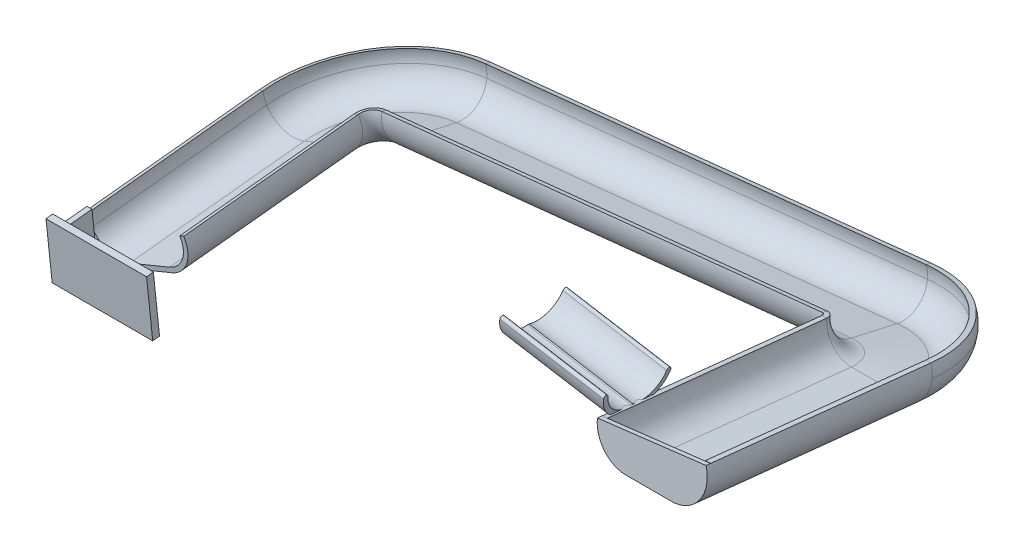
from build123d import *

# Parameters (mm, degrees)
SKETCH_2_W      = 0.546487167
SKETCH_2_H      = 4.918384508
EXTRUDE_1_DEPTH = 3.6
EXTRUDE_2_DEPTH = 11
EXTRUDE_START   = 0.5
EXTRUDE_4_DEPTH = 0.5
EXTRUDE_5_DEPTH = 11.5


with BuildPart() as part:
    # 扫描1: sweep along a curve in space
    with BuildLine() as sweep_1_path:
        Line((60, 6.926609333, 5.902285627), (60, 9.459381174, 30))
        ThreePointArc((54.097714373, 5.685898899, 0), (58.275153099, 6.306254116, 1.724846901), (60, 6.926609333, 5.902285627))
        Line((5.902285627, 0.620355217, 0), (54.097714373, 5.685898899, 0))
        ThreePointArc((0, -0.620355217, 5.902285627), (1.724846901, 0, 1.724846901), (5.902285627, 0.620355217, 0))
        Line((0, -0.620355217, 5.902285627), (0, -2.627605882, 25))
    # 草图1 → 扫描1 (sweep)
    with BuildSketch(Plane(origin=(60, 9.459381174, 30), x_dir=(1, 0, 0), z_dir=(0, 0.10452846326765572, 0.9945218953682732))):
        with BuildLine():
            Line((-6, 3.25), (-5.5, 3.25))
            ThreePointArc((-5.5, 3.25), (-4.621320344, 1.128679656), (-2.5, 0.25))
            Line((-2.5, 0.25), (2.5, 0.25))
            ThreePointArc((2.5, 0.25), (4.621320344, 1.128679656), (5.5, 3.25))
            ThreePointArc((5.5, 3.25), (5.42374237, 3.922109036), (5.198846296, 4.56004911))
            Line((5.198846296, 4.56004911), (5.745577195, 4.56004911))
            ThreePointArc((5.745577195, 4.56004911), (5.935805596, 3.917262998), (6, 3.25))
            ThreePointArc((6, 3.25), (4.974873734, 0.775126266), (2.5, -0.25))
            Line((2.5, -0.25), (-2.5, -0.25))
            ThreePointArc((-2.5, -0.25), (-4.974873734, 0.775126266), (-6, 3.25))
        make_face()
    sweep(path=sweep_1_path.line)

    # 草图2 → 凸台-拉伸1 (add)
    with BuildSketch(Plane(origin=(0, -2.627605882, 25), x_dir=(1, 0, 0), z_dir=(0, -0.1045284632676537, 0.9945218953682733))):
        with Locations((-6.423000936, 0.189458264)):
            Rectangle(SKETCH_2_W, SKETCH_2_H)
    extrude(amount=EXTRUDE_1_DEPTH)

    # 草图3 → 凸台-拉伸2 (add)
    with BuildSketch(Plane.ZY.offset(6.696244519)):
        Polygon((28.343027017, -5.261208499), (29.016349178, 1.145023935), (29.760098321, 1.06685275), (29.08677616, -5.339379684), align=None)
    extrude(amount=-EXTRUDE_2_DEPTH)

    # 草图5 → 凸台-拉伸4 (add)
    with BuildSketch(Plane(origin=(0, 3.222030449, 30.655571978), x_dir=(1, 0, 0), z_dir=(0, 0.10452846326765573, 0.9945218953682732)).offset(EXTRUDE_START)):
        with BuildLine():
            Line((65.745577195, 10.831756906), (54, 9.521707796))
            ThreePointArc((54, 9.521707796), (55.025126266, 7.046834062), (57.5, 6.021707796))
            Line((57.5, 6.021707796), (62.5, 6.021707796))
            ThreePointArc((62.5, 6.021707796), (64.974873734, 7.046834062), (66, 9.521707796))
            ThreePointArc((66, 9.521707796), (65.935805596, 10.188970794), (65.745577195, 10.831756906))
        make_face()
    extrude(amount=-EXTRUDE_4_DEPTH)

    # 草图6 → 凸台-拉伸5 (add)
    with BuildSketch(Plane(origin=(42.920636483, 14.309369815, 26.591437724), x_dir=(0, 0, 1), z_dir=(-0.9862492496089712, 0.16526468965190708, -2.582698329999371e-13))):
        with BuildLine():
            ThreePointArc((3.06884477, 2.502193657), (3.331726952, 2.738610574), (3.568143869, 2.475728392))
            ThreePointArc((3.568143869, 2.475728392), (2.699777506, 0.459022922), (0.729316838, -0.509711228))
            Line((0.729316838, -0.509711228), (-0.642859848, -0.651949655))
            ThreePointArc((-0.642859848, -0.651949655), (-2.66156717, -0.179875455), (-3.957168488, 1.438596209))
            ThreePointArc((-3.957168488, 1.438596209), (-3.805502668, 1.75796665), (-3.486132226, 1.606300829))
            ThreePointArc((-3.486132226, 1.606300829), (-2.093455907, 0.078991816), (-0.027928349, 0.002728684))
            Line((-0.027928349, 0.002728684), (0.142811981, -0.013953159))
            ThreePointArc((0.142811981, -0.013953159), (2.143390616, 0.618987912), (3.06884477, 2.502193657))
        make_face()
    extrude(amount=-EXTRUDE_5_DEPTH)


solid = part.part
